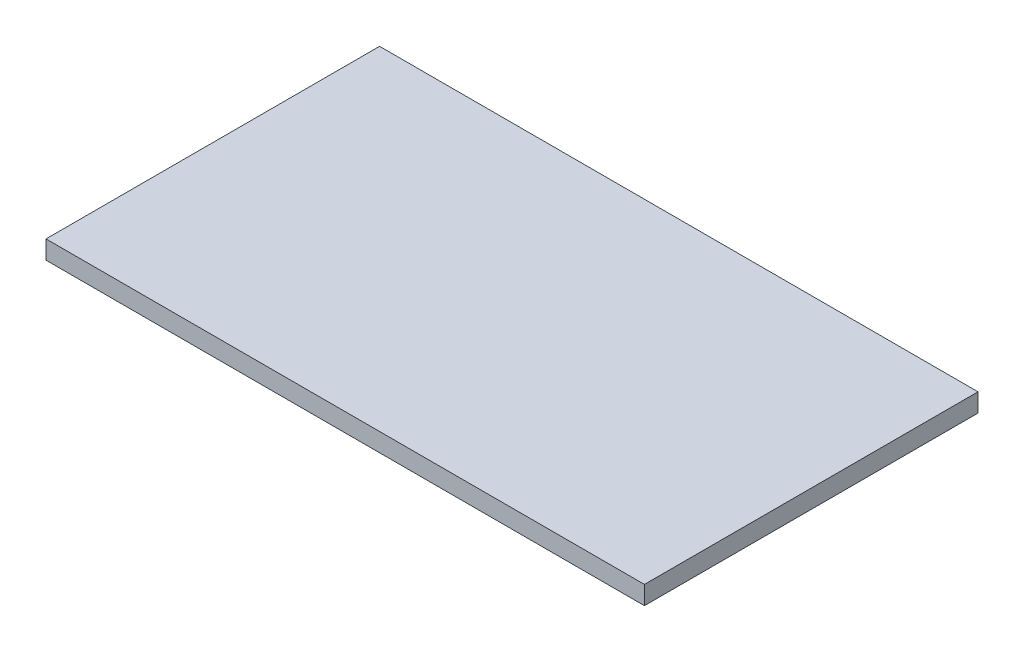
from build123d import *

# Parameters (mm, degrees)
SKETCH1_W           = 154.1
SKETCH1_H           = 85.9
BOSS_EXTRUDE1_DEPTH = 4.75


with BuildPart() as part:
    # Sketch1 → Boss-Extrude1 (new body)
    with BuildSketch(Plane(origin=(0, 0, 0), x_dir=(1, 0, 0), z_dir=(0, 1, 0))):
        Rectangle(SKETCH1_W, SKETCH1_H)
    extrude(amount=BOSS_EXTRUDE1_DEPTH)


solid = part.part
